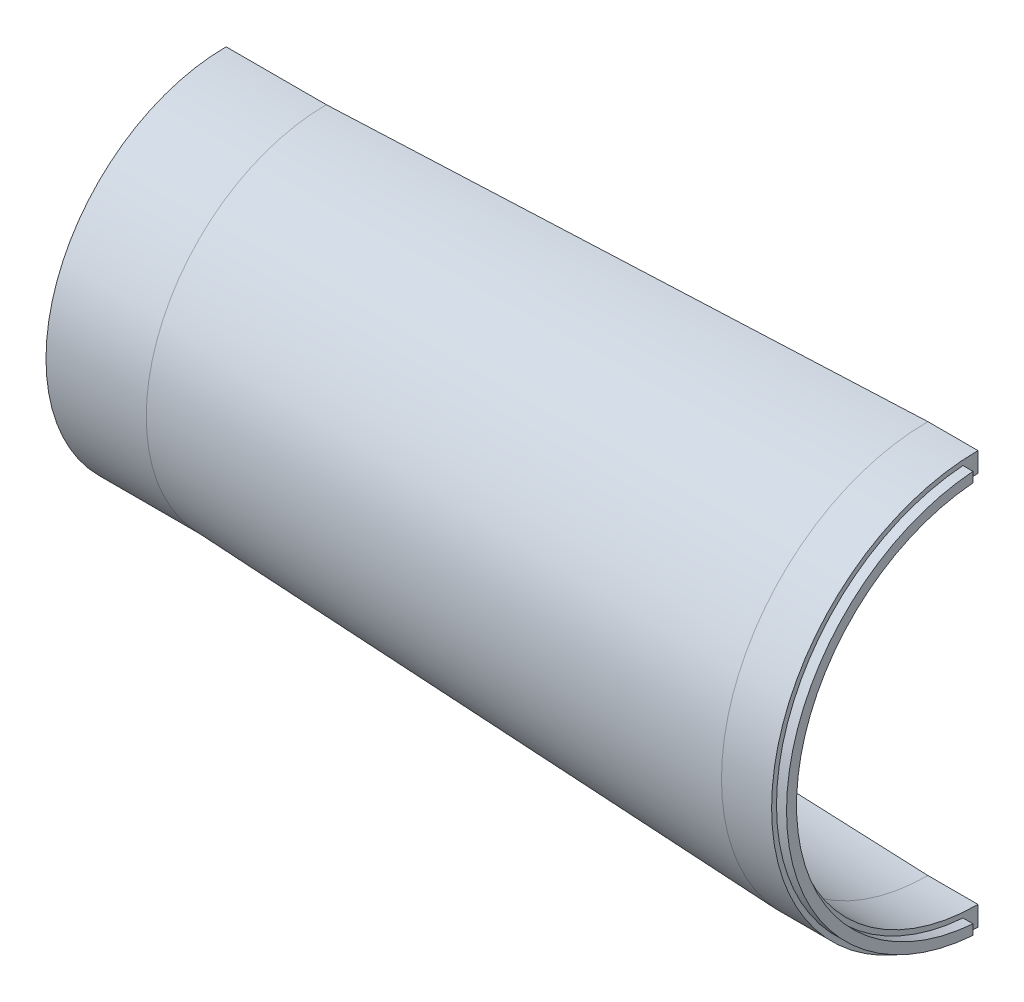
from build123d import *

# Parameters (mm, degrees)
REVOLVE2_ANGLE      = 180
SKETCH4_W           = 20.32
SKETCH4_H           = 20.32
CUT_EXTRUDE2_DEPTH  = 32.004
BOSS_EXTRUDE2_DEPTH = 2.54
SKETCH5_W           = 2.54
SKETCH5_H           = 12.7
SKETCH5_W_2         = 12.7
SKETCH5_H_2         = 2.54
CUT_EXTRUDE3_DEPTH  = 2.54


with BuildPart() as part:
    # Sketch2 → Revolve2 (revolve)
    with BuildSketch(Plane.XY):
        Polygon((0, 0), (0, 40.64), (0, 45.63872), (25.4, 45.63872), (177.8, 52.292647699), (190.5, 52.292647699), (190.5, 47.293927699), (177.8, 47.293927699), (25.4, 40.64), (4.99872, 40.64), (4.99872, 0), align=None)
    revolve(axis=Axis((0, 0, 0), (1, 0, 0)), revolution_arc=REVOLVE2_ANGLE)

    # Sketch4 → Cut-Extrude2 (cut)
    with BuildSketch(Plane.ZY):
        with Locations((10.16, 10.16)):
            Rectangle(SKETCH4_W, SKETCH4_H)
        with Locations((10.16, -10.16)):
            Rectangle(SKETCH4_W, SKETCH4_H)
    extrude(amount=-CUT_EXTRUDE2_DEPTH, mode=Mode.SUBTRACT)

    # Sketch6 → Boss-Extrude2 (add)
    with BuildSketch(Plane(origin=(190.5, 0, 0), x_dir=(0, 0, -1), z_dir=(1, 0, 0))):
        with BuildLine():
            Line((-3.81, 50.911637334), (-3.81, 48.371637334))
            ThreePointArc((-3.81, 48.371637334), (-48.52145297, 0), (-3.81, -48.371637334))
            Line((-3.81, -48.371637334), (-3.81, -50.911637334))
            ThreePointArc((-3.81, -50.911637334), (-51.054, 0), (-3.81, 50.911637334))
        make_face()
    extrude(amount=BOSS_EXTRUDE2_DEPTH)

    # Sketch5 → Cut-Extrude3 (cut)
    with BuildSketch(Plane(origin=(0, 0, 0), x_dir=(-1, 0, 0), z_dir=(0, 0, -1))):
        with Locations((-2.49936, 34.29)):
            Rectangle(SKETCH5_W, SKETCH5_H)
        Polygon((-152.4, 49.954299749), (-152.4, 47.414299749), (-50.8, 42.97834795), (-50.8, 45.51834795), align=None)
        with Locations((-11.34872, 43.13936)):
            Rectangle(SKETCH5_W_2, SKETCH5_H_2)
        Polygon((-50.8, -42.97834795), (-50.8, -45.51834795), (-152.4, -49.954299749), (-152.4, -47.414299749), align=None)
        with Locations((-11.34872, -43.13936)):
            Rectangle(SKETCH5_W_2, SKETCH5_H_2)
        with Locations((-2.49936, -34.29)):
            Rectangle(SKETCH5_W, SKETCH5_H)
    extrude(amount=-CUT_EXTRUDE3_DEPTH, mode=Mode.SUBTRACT)


solid = part.part
